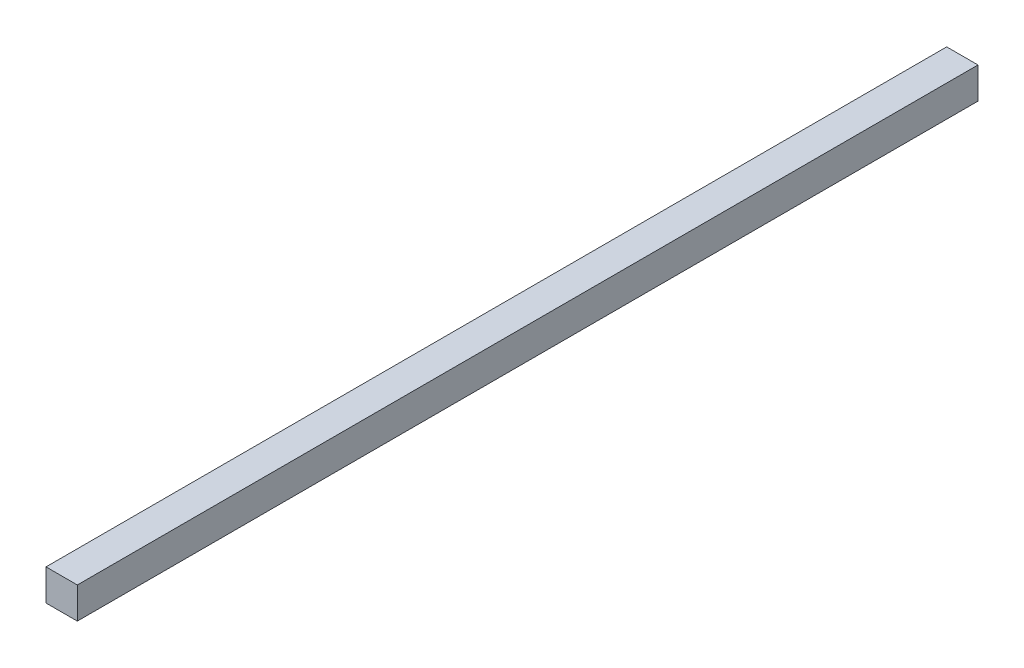
from build123d import *

# Parameters (mm, degrees)
SKETCH1_W           = 20
SKETCH1_H           = 20
BOSS_EXTRUDE1_DEPTH = 575


with BuildPart() as part:
    # Sketch1 → Boss-Extrude1 (new body)
    with BuildSketch(Plane.XY):
        Rectangle(SKETCH1_W, SKETCH1_H)
    extrude(amount=BOSS_EXTRUDE1_DEPTH)


solid = part.part
